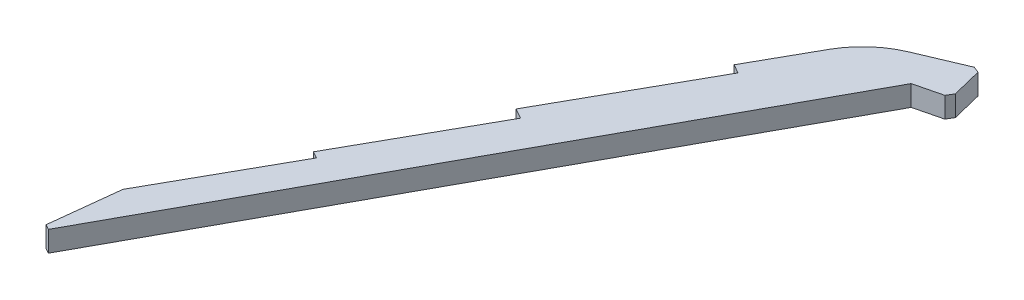
from build123d import *

# Parameters (mm, degrees)
EXTRUDE_2_DEPTH      = 0.95
EXTRUDE_2_DEPTH_BACK = 0.95
FILLET_6_R           = 8
CHAMFER_1_SIZE       = 0.5
CHAMFER_2_SIZE       = 0.5
CHAMFER_2_SIZE2      = 0.436431784


with BuildPart() as part:
    # 草图3 → 凸台-拉伸2 (new, two sides: drawn at the far end of the back side and taken through both)
    with BuildSketch(Plane(origin=(0, 0, 0), x_dir=(1, 0, 0), z_dir=(0, 1, 0)).offset(-EXTRUDE_2_DEPTH_BACK)):
        Polygon((-187.120164296, -75.485656639), (-188.025009302, -71.812776929), (-195.252497915, -74.872539862), (-199.736508362, -82.868381819), (-198.907982221, -83.333013297), (-206.244927345, -96.416179437), (-205.305528647, -96.942987446), (-212.153344095, -109.15394251), (-211.528903604, -109.50412423), (-217.926627044, -120.91247979), (-218.646393726, -127.274440762), (-218.168094082, -127.536139913), (-190.089143959, -76.21708991), align=None)
    extrude(amount=EXTRUDE_2_DEPTH + EXTRUDE_2_DEPTH_BACK)

    # 圆角6
    fillet_6_edges = [part.edges().sort_by_distance(p)[0] for p in [
        (-195.252497915, 0, 74.872539862),
    ]]
    fillet(fillet_6_edges, radius=FILLET_6_R)

    # 倒角1
    chamfer_1_edges = [part.edges().sort_by_distance(p)[0] for p in [
        (-187.120164296, 0, 75.485656639),
    ]]
    chamfer(chamfer_1_edges, length=CHAMFER_1_SIZE)

    # 倒角2
    chamfer_2_edges = [part.edges().sort_by_distance(p)[0] for p in [
        (-188.025009302, 0, 71.812776929),
    ]]
    chamfer_2_side = [part.faces().sort_by_distance(p)[0] for p in [
        (-190.378641555, 0, 72.809188977),
    ]]
    chamfer(chamfer_2_edges, length=CHAMFER_2_SIZE, length2=CHAMFER_2_SIZE2, reference=chamfer_2_side[0])


solid = part.part
